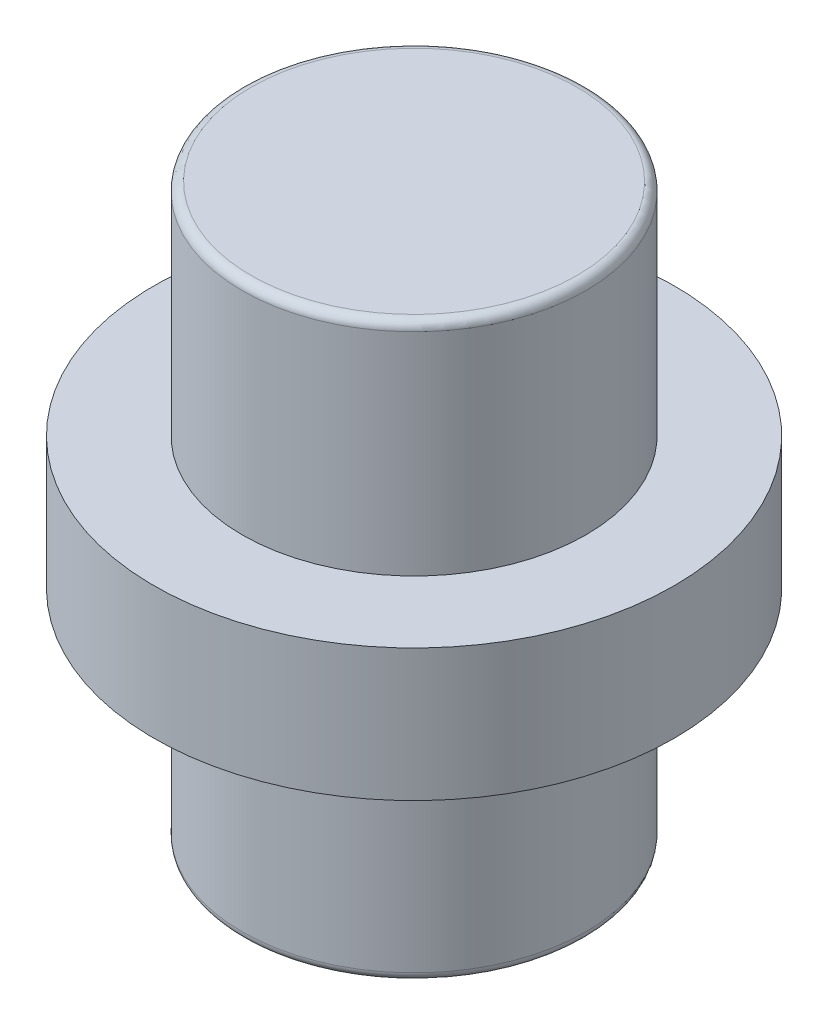
from build123d import *

# Parameters (mm, degrees)
FILLET1_R = 0.2


with BuildPart() as part:
    # Sketch1 → Revolve1 (revolve)
    with BuildSketch(Plane.XY):
        Polygon((0, 0), (3.9, 0), (3.9, 5), (5.9, 5), (5.9, 8), (3.9, 8), (3.9, 13), (0, 13), align=None)
    revolve(axis=Axis((0, 0, 0), (0, 1, 0)))

    # Fillet1
    fillet1_edges = [part.edges().sort_by_distance(p)[0] for p in [
        (-3.9, 13, 0),
        (-3.9, 0, 0),
    ]]
    fillet(fillet1_edges, radius=FILLET1_R)


solid = part.part
